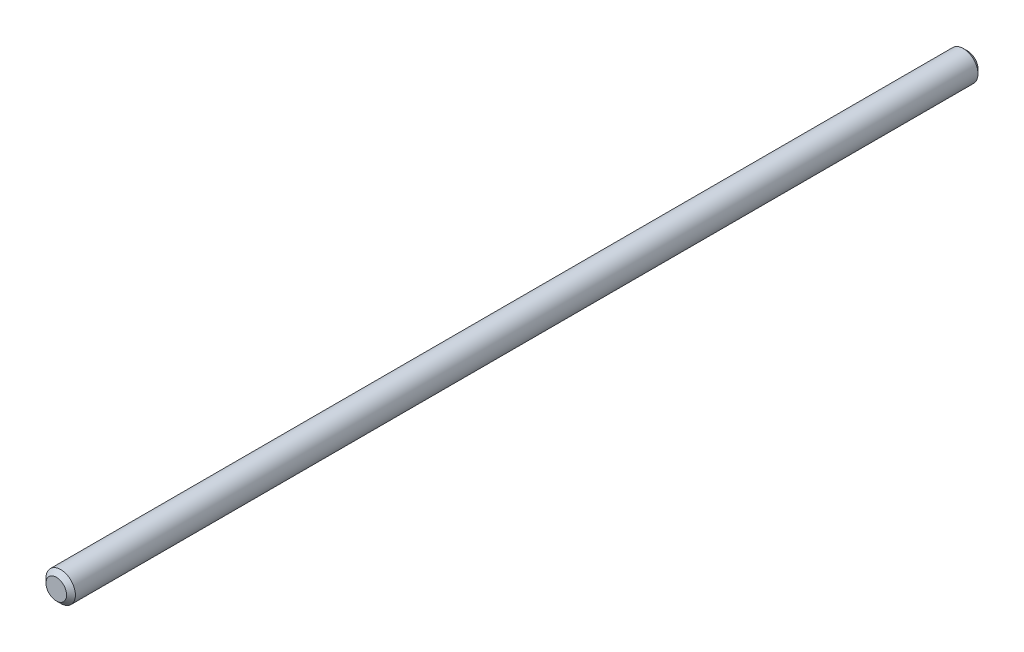
from build123d import *

# Parameters (mm, degrees)
SKETCH1_R           = 2.5
BOSS_EXTRUDE1_DEPTH = 155
CHAMFER1_SIZE       = 0.75


with BuildPart() as part:
    # Sketch1 → Boss-Extrude1 (new body)
    with BuildSketch(Plane.XY):
        Circle(SKETCH1_R)
    extrude(amount=BOSS_EXTRUDE1_DEPTH)

    # Chamfer1
    chamfer1_edges = [part.edges().sort_by_distance(p)[0] for p in [
        (-2.5, 0, 0),
        (-2.5, 0, 155),
    ]]
    chamfer(chamfer1_edges, length=CHAMFER1_SIZE)


solid = part.part
